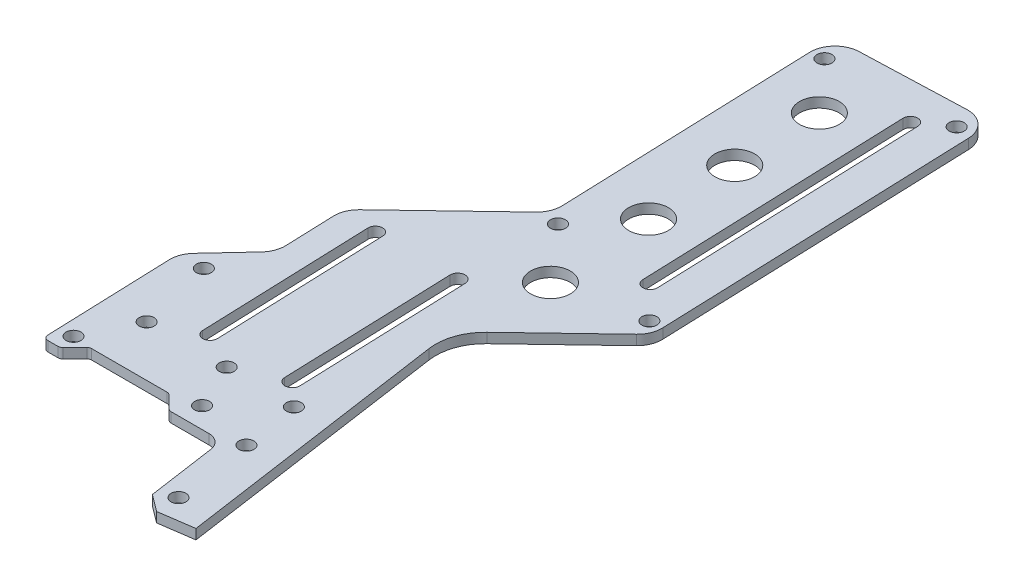
from build123d import *

# Parameters (mm, degrees)
SKETCH1_R           = 1.5
BOSS_EXTRUDE1_DEPTH = 2
SKETCH2_R           = 4
CUT_EXTRUDE1_DEPTH  = 136.757961465
SKETCH3_R           = 1.5
CUT_EXTRUDE2_DEPTH  = 10
FILLET1_R           = 10
CUT_EXTRUDE3_DEPTH  = 23
FILLET2_R           = 1


with BuildPart() as part:
    # Sketch1 → Boss-Extrude1 (new body)
    with BuildSketch(Plane(origin=(0, 0, 0), x_dir=(1, 0, 0), z_dir=(0, 1, 0))):
        with BuildLine():
            Line((35.946087305, 32.589224444), (55.068611132, 50.836380863))
            ThreePointArc((55.068611132, 50.836380863), (56.248023483, 52.569022886), (56.613633222, 54.632852189))
            Line((56.613633222, 54.632852189), (54.322448331, 118.551544644))
            ThreePointArc((54.322448331, 118.551544644), (52.732271224, 122.032348819), (49.146545971, 123.369224039))
            Line((49.146545971, 123.369224039), (28.149749669, 122.616587516))
            ThreePointArc((28.149749669, 122.616587516), (24.668945494, 121.026410408), (23.332070273, 117.440685156))
            Line((23.332070273, 117.440685156), (25.181696492, 65.840445524))
            ThreePointArc((25.181696492, 65.840445524), (24.816086753, 63.776616221), (23.636674402, 62.043974198))
            Line((23.636674402, 62.043974198), (5.476247543, 44.714873053))
            ThreePointArc((5.476247543, 44.714873053), (4.296835192, 42.98223103), (3.931225452, 40.918401728))
            Line((3.931225452, 40.918401728), (4.285331317, 31.039677436))
            ThreePointArc((4.285331317, 31.039677436), (3.973516256, 29.113854302), (2.948456097, 27.453952183))
            Line((2.948456097, 27.453952183), (-3.659915658, 20.354208893))
            ThreePointArc((-3.659915658, 20.354208893), (-4.684975817, 18.694306775), (-4.996790878, 16.768483641))
            Line((-4.996790878, 16.768483641), (-4.053596951, -9.544417952))
            Line((-4.053596951, -9.544417952), (-0.700132194, -9.544417952))
            Line((-0.700132194, -9.544417952), (2.299867806, -6.544417952))
            Line((2.299867806, -6.544417952), (18.299867806, -6.544417952))
            Line((18.299867806, -6.544417952), (21.299867806, -9.544417952))
            Line((21.299867806, -9.544417952), (26.299867806, -9.544417952))
            Line((26.299867806, -9.544417952), (28.299867806, -9.544417952))
            Line((28.299867806, -9.544417952), (29.317405641, -9.544417952))
            ThreePointArc((29.317405641, -9.544417952), (31.281555871, -10.276794995), (32.286707076, -12.116342036))
            Line((32.286707076, -12.116342036), (34.27107148, -25.880667111))
            Line((34.27107148, -25.880667111), (37.668448831, -28.421892629))
            Line((37.668448831, -28.421892629), (44.597867771, -27.422897603))
            Line((44.597867771, -27.422897603), (40.206014976, 3.040705467))
            Line((40.206014976, 3.040705467), (35.946087305, 32.589224444))
        make_face()
        with Locations(Location((23.770367042, -5.370271096, 0), (0, 0, 270))):
            Circle(SKETCH1_R, mode=Mode.SUBTRACT)
        with Locations(Location((19.540458754, 3.826449386, 0), (0, 0, 270))):
            Circle(SKETCH1_R, mode=Mode.SUBTRACT)
        with Locations(Location((-1.280541484, -6.226605145, 0), (0, 0, 270))):
            Circle(SKETCH1_R, mode=Mode.SUBTRACT)
        with Locations(Location((3.564149135, 3.664002019, 0), (0, 0, 270))):
            Circle(SKETCH1_R, mode=Mode.SUBTRACT)
    extrude(amount=BOSS_EXTRUDE1_DEPTH)

    # Sketch2 → Cut-Extrude1 (cut, through all)
    with BuildSketch(Plane.XZ):
        with Locations(Location((34.893536441, -107.909402778, 0), (0, 0, 270))):
            Circle(SKETCH2_R)
        with Locations(Location((35.500605714, -90.244703074, 0), (0, 0, 270))):
            Circle(SKETCH2_R)
        with Locations(Location((37.375632996, -51.234404776, 0), (0, 0, 270))):
            Circle(SKETCH2_R)
        with Locations(Location((36.193690526, -72.178757044, 0), (0, 0, 270))):
            Circle(SKETCH2_R)
        with BuildLine():
            Line((9.476681481, -42.336326168), (10.714476932, -7.804732036))
            ThreePointArc((10.714476932, -7.804732036), (12.221884959, -6.401651358), (13.624965636, -7.909059385))
            Line((13.624965636, -7.909059385), (12.387170186, -42.440653517))
            ThreePointArc((12.387170186, -42.440653517), (10.879762159, -43.843734194), (9.476681481, -42.336326168))
        make_face()
        with BuildLine():
            Line((25.946876638, -42.39809035), (27.184672089, -7.866496218))
            ThreePointArc((27.184672089, -7.866496218), (28.736682558, -6.421900022), (30.181278754, -7.973910491))
            Line((30.181278754, -7.973910491), (28.943483303, -42.505504623))
            ThreePointArc((28.943483303, -42.505504623), (27.391472834, -43.950100819), (25.946876638, -42.39809035))
        make_face()
        with BuildLine():
            Line((44.239527936, -115.417065328), (46.189170661, -61.026599384))
            ThreePointArc((46.189170661, -61.026599384), (47.693530634, -59.626355806), (49.093774212, -61.130715778))
            Line((49.093774212, -61.130715778), (47.144131486, -115.521181722))
            ThreePointArc((47.144131486, -115.521181722), (45.639771514, -116.9214253), (44.239527936, -115.417065328))
        make_face()
    extrude(amount=-CUT_EXTRUDE1_DEPTH, mode=Mode.SUBTRACT)

    # Sketch3 → Cut-Extrude2 (cut)
    with BuildSketch(Plane(origin=(0, 2, 0), x_dir=(1, 0, 0), z_dir=(0, 1, 0))):
        with Locations(Location((0, 18.76051869, 0), (0, 0, 270))):
            Circle(SKETCH3_R)
        with Locations(Location((54.054577559, 54.488184987, 0), (0, 0, 270))):
            Circle(SKETCH3_R)
        with Locations(Location((25.943400363, 117.871083174, 0), (0, 0, 270))):
            Circle(SKETCH3_R)
        with Locations(Location((51.146049593, 119.311681239, 0), (0, 0, 270))):
            Circle(SKETCH3_R)
        with Locations(Location((27.939408723, 62.187124606, 0), (0, 0, 270))):
            Circle(SKETCH3_R)
        with Locations(Location((33.240387063, 3.660878573, 0), (0, 0, 270))):
            Circle(SKETCH3_R)
    extrude(amount=-CUT_EXTRUDE2_DEPTH, mode=Mode.SUBTRACT)

    # Fillet1
    fillet1_edges = [part.edges().sort_by_distance(p)[0] for p in [
        (35.946087305, 1, -32.589224444),
    ]]
    fillet(fillet1_edges, radius=FILLET1_R)

    # Sketch4 → Cut-Extrude3 (cut)
    with BuildSketch(Plane.XZ):
        with BuildLine():
            ThreePointArc((36.806162994, 22.440741914), (38.934316746, 23.581659248), (37.215093343, 25.27724223))
            ThreePointArc((37.215093343, 25.27724223), (35.965015311, 24.009735165), (36.806162994, 22.440741914))
        make_face()
        with BuildLine():
            ThreePointArc((34.909100758, 9.281978715), (33.659022726, 8.014471651), (34.500170409, 6.4454784))
            ThreePointArc((34.500170409, 6.4454784), (36.628324161, 7.586395734), (34.909100758, 9.281978715))
        make_face()
    extrude(amount=-CUT_EXTRUDE3_DEPTH, mode=Mode.SUBTRACT)

    # Fillet2
    fillet2_edges = [part.edges().sort_by_distance(p)[0] for p in [
        (21.299867806, 1, 9.544417952),
        (18.299867806, 1, 6.544417952),
        (2.299867806, 1, 6.544417952),
        (-0.700132194, 1, 9.544417952),
        (-4.053596951, 1, 9.544417952),
    ]]
    fillet(fillet2_edges, radius=FILLET2_R)


solid = part.part
